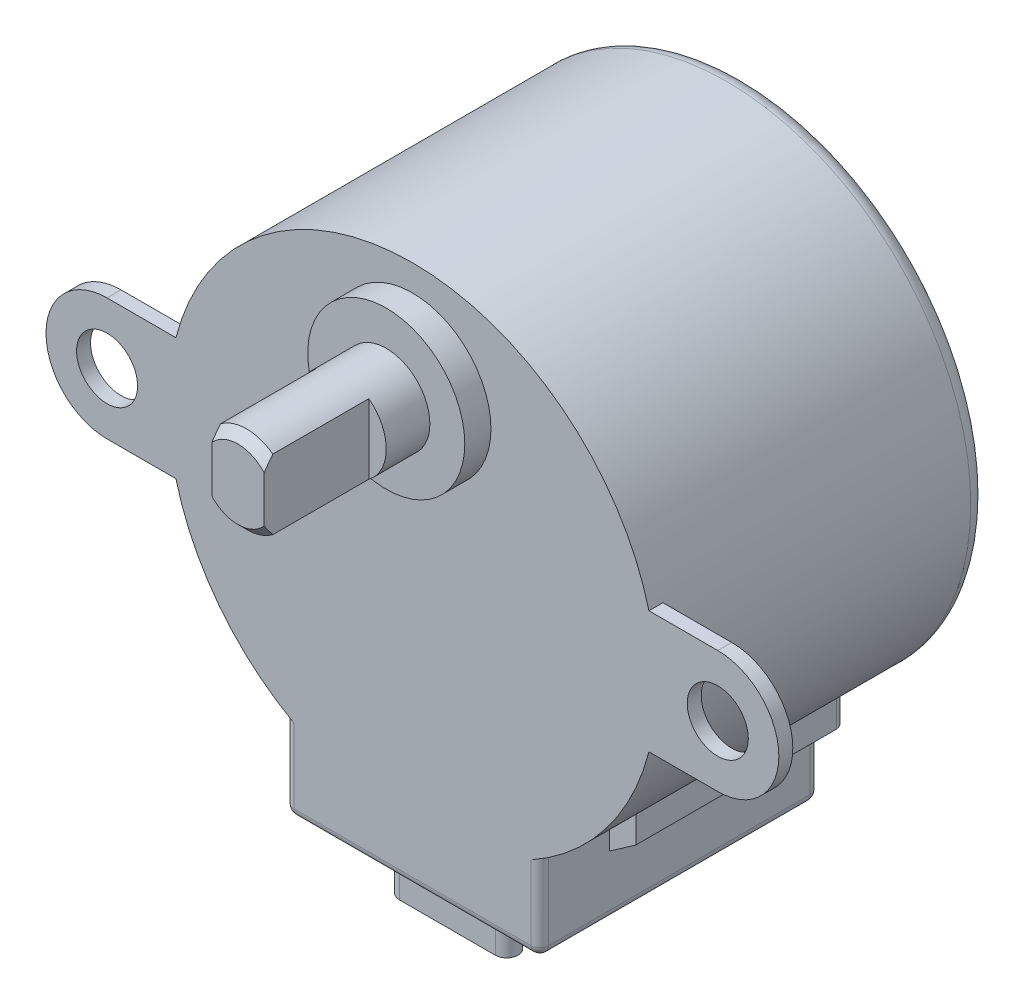
from build123d import *

# Parameters (mm, degrees)
ESBO_O1_R                = 14
RESSALTO_EXTRUS_O1_DEPTH = 19
ESBO_O2_R                = 4.5
RESSALTO_EXTRUS_O2_DEPTH = 1.5
ESBO_O3_R                = 2.5
RESSALTO_EXTRUS_O3_DEPTH = 10
CORTE_EXTRUS_O1_DEPTH    = 6
CHANFRO2_SIZE            = 0.5
ESBO_O6_R                = 1.75
RESSALTO_EXTRUS_O5_DEPTH = 0.8
FILETE1_R                = 1
RESSALTO_EXTRUS_O6_START = -16
RESSALTO_EXTRUS_O6_DEPTH = 16
RESSALTO_EXTRUS_O7_DEPTH = 12
FILETE2_R                = 0.5
RESSALTO_EXTRUS_O8_DEPTH = 3


with BuildPart() as part:
    # Esboço1 → Ressalto-extrusão1 (new body)
    with BuildSketch(Plane.XY):
        Circle(ESBO_O1_R)
    extrude(amount=RESSALTO_EXTRUS_O1_DEPTH)

    # Esboço2 → Ressalto-extrusão2 (add)
    with BuildSketch(Plane.XY.offset(19)):
        with Locations((0, 8)):
            Circle(ESBO_O2_R)
    extrude(amount=RESSALTO_EXTRUS_O2_DEPTH)

    # Esboço3 → Ressalto-extrusão3 (add)
    with BuildSketch(Plane.XY.offset(19)):
        with Locations((0, 8)):
            Circle(ESBO_O3_R)
    extrude(amount=RESSALTO_EXTRUS_O3_DEPTH)

    # Esboço5 → Corte-extrusão1 (cut)
    with BuildSketch(Plane.XY.offset(29)):
        with BuildLine():
            Line((-1.5, 10.58624067), (-1.5, 5.41375933))
            ThreePointArc((-1.5, 5.41375933), (-2.989755977, 8), (-1.5, 10.58624067))
        make_face()
        with BuildLine():
            Line((1.5, 10.58624067), (1.5, 5.41375933))
            ThreePointArc((1.5, 5.41375933), (2.989755977, 8), (1.5, 10.58624067))
        make_face()
    extrude(amount=-CORTE_EXTRUS_O1_DEPTH, mode=Mode.SUBTRACT)

    # Chanfro2
    chanfro2_edges = [part.edges().sort_by_distance(p)[0] for p in [
        (0, 10.5, 29),
        (0, 5.5, 29),
    ]]
    chamfer(chanfro2_edges, length=CHANFRO2_SIZE)

    # Esboço6 → Ressalto-extrusão5 (add)
    with BuildSketch(Plane.XY.offset(19)):
        with BuildLine():
            Line((17.5, 3.5), (-17.5, 3.5))
            ThreePointArc((-17.5, 3.5), (-21, 0), (-17.5, -3.5))
            Line((-17.5, -3.5), (17.5, -3.5))
            ThreePointArc((17.5, -3.5), (21, 0), (17.5, 3.5))
        make_face()
        with Locations((-17.5, 0)):
            Circle(ESBO_O6_R, mode=Mode.SUBTRACT)
        with Locations((17.5, 0)):
            Circle(ESBO_O6_R, mode=Mode.SUBTRACT)
    extrude(amount=-RESSALTO_EXTRUS_O5_DEPTH)

    # Filete1
    filete1_edges = [part.edges().sort_by_distance(p)[0] for p in [
        (-14, 0, 0),
    ]]
    fillet(filete1_edges, radius=FILETE1_R)

    # Esboço7 → Ressalto-extrusão6 (add)
    with BuildSketch(Plane.XY.offset(19).offset(RESSALTO_EXTRUS_O6_START)):
        with BuildLine():
            Line((7.3, -17), (-7.3, -17))
            Line((-7.3, -17), (-7.3, -11.94612908))
            ThreePointArc((-7.3, -11.94612908), (0, -14), (7.3, -11.94612908))
            Line((7.3, -11.94612908), (7.3, -17))
        make_face()
    extrude(amount=RESSALTO_EXTRUS_O6_DEPTH)

    # Esboço8 → Ressalto-extrusão7 (add)
    with BuildSketch(Plane(origin=(0, 0, 3), x_dir=(-1, 0, 0), z_dir=(0, 0, -1))):
        with BuildLine():
            Line((-7.3, -13.555946275), (-8.8, -12.505634968))
            Line((-8.8, -12.505634968), (-8.8, -10.888526071))
            ThreePointArc((-8.8, -10.888526071), (-8.067349691, -11.441934669), (-7.3, -11.94612908))
            Line((-7.3, -11.94612908), (-7.3, -13.555946275))
        make_face()
        with BuildLine():
            Line((7.3, -13.555946275), (7.3, -11.94612908))
            ThreePointArc((7.3, -11.94612908), (8.067349691, -11.441934669), (8.8, -10.888526071))
            Line((8.8, -10.888526071), (8.8, -12.505634968))
            Line((8.8, -12.505634968), (7.3, -13.555946275))
        make_face()
    extrude(amount=-RESSALTO_EXTRUS_O7_DEPTH)

    # Filete2
    filete2_edges = [part.edges().sort_by_distance(p)[0] for p in [
        (7.3, -14.47306454, 19),
        (-7.3, -15.277973138, 3),
        (8.8, -11.69708052, 3),
        (8.05, -13.030790622, 3),
        (-8.05, -13.030790622, 3),
        (-8.8, -11.69708052, 3),
        (-7.3, -17, 11),
        (7.3, -15.277973138, 3),
        (0, -17, 3),
        (7.3, -17, 11),
        (-7.3, -14.47306454, 19),
        (0, -17, 19),
    ]]
    fillet(filete2_edges, radius=FILETE2_R)

    # Esboço9 → Ressalto-extrusão8 (add)
    with BuildSketch(Plane.XZ.offset(17)):
        with BuildLine():
            Line((-2.75, 17), (2.75, 17))
            ThreePointArc((2.75, 17), (3.4, 16.35), (2.75, 15.7))
            Line((2.75, 15.7), (-2.75, 15.7))
            ThreePointArc((-2.75, 15.7), (-3.4, 16.35), (-2.75, 17))
        make_face()
    extrude(amount=RESSALTO_EXTRUS_O8_DEPTH)


solid = part.part
